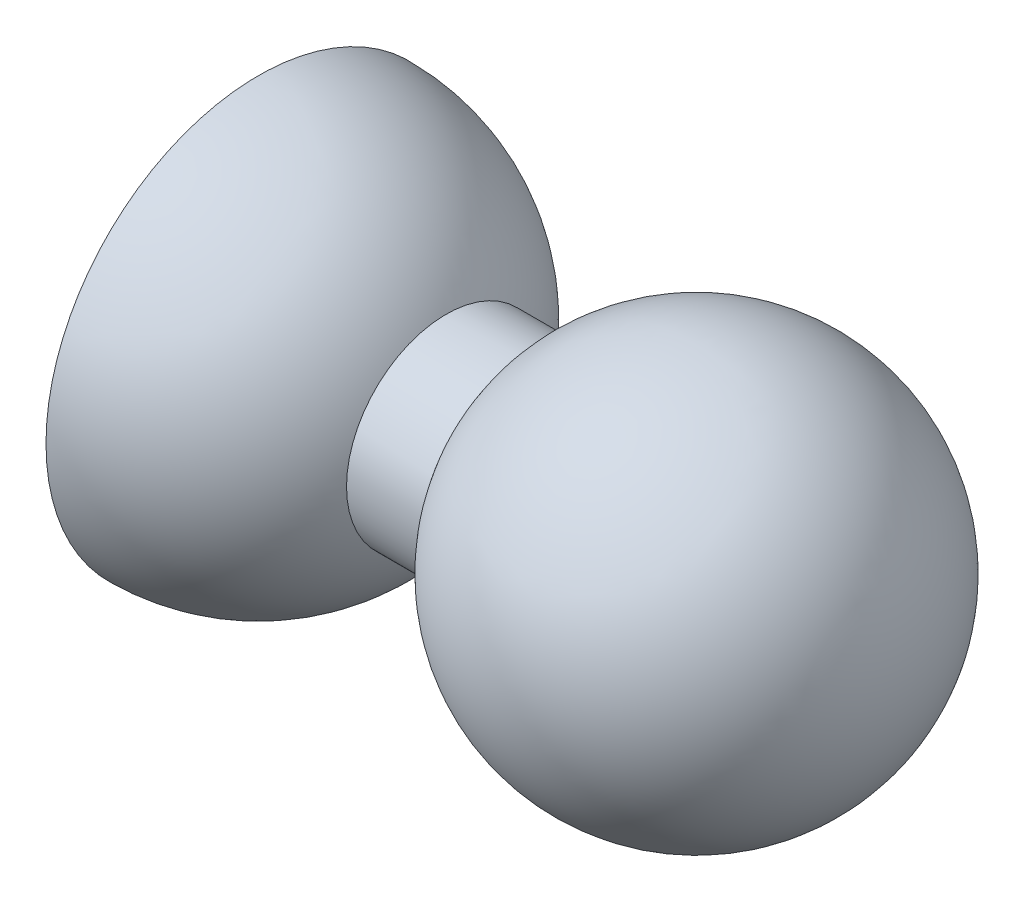
from build123d import *
from build123d.topology import SkipClean

# Parameters (mm, degrees)
SALIENTE_EXTRUIR1_REACH      = 49.713
SALIENTE_EXTRUIR1_END_RADIUS = 16
SALIENTE_EXTRUIR1_START      = -20
CROQUIS2_R                   = 7.5


with BuildPart() as part:
    # Croquis1 → Revolución-Lámina1 (revolve)
    with BuildSketch(Plane.XY):
        with BuildLine():
            ThreePointArc((15, 0), (10.606601718, 10.606601718), (0, 15))
            Line((0, 15), (0, 16))
            ThreePointArc((0, 16), (11.313708499, 11.313708499), (16, 0))
            Line((16, 0), (15, 0))
        make_face()
    revolve(axis=Axis((0, 0, 0), (1, 0, 0)))

    # Saliente-Extruir1: up to this sphere (the profile starts outside it)
    with SkipClean():  # the faces are left unmerged after this step: merging them gives an invalid solid
        saliente_extruir1_end = Location((0, 0, 0)) * Sphere(SALIENTE_EXTRUIR1_END_RADIUS, mode=Mode.PRIVATE)
        # Croquis2 → Saliente-Extruir1 (add, up to the surface)
        with BuildSketch(Plane.ZY.offset(SALIENTE_EXTRUIR1_START), mode=Mode.PRIVATE) as saliente_extruir1_sk1:
            Circle(CROQUIS2_R)
        saliente_extruir1_tool1 = extrude(saliente_extruir1_sk1.sketch, amount=SALIENTE_EXTRUIR1_REACH, mode=Mode.PRIVATE) - saliente_extruir1_end
        add(saliente_extruir1_tool1.solids().sort_by_distance((20, 0, 0))[0])

    # Croquis5 → Revolución1 (revolve)
    with BuildSketch(Plane.XY, mode=Mode.PRIVATE) as revoluci_n1_sk:
        with BuildLine():
            Line((20, 7.5), (20, 0))
            Line((20, 0), (47.990381057, 0))
            ThreePointArc((47.990381057, 0), (43.596982775, 10.606601718), (32.990381057, 15))
            ThreePointArc((32.990381057, 15), (25.490381057, 12.990381057), (20, 7.5))
        make_face()
    revolve(revoluci_n1_sk.sketch.rotate(Axis((20, 0, 0), (1, 0, 0)), 90), axis=Axis((20, 0, 0), (1, 0, 0)))


solid = part.part
